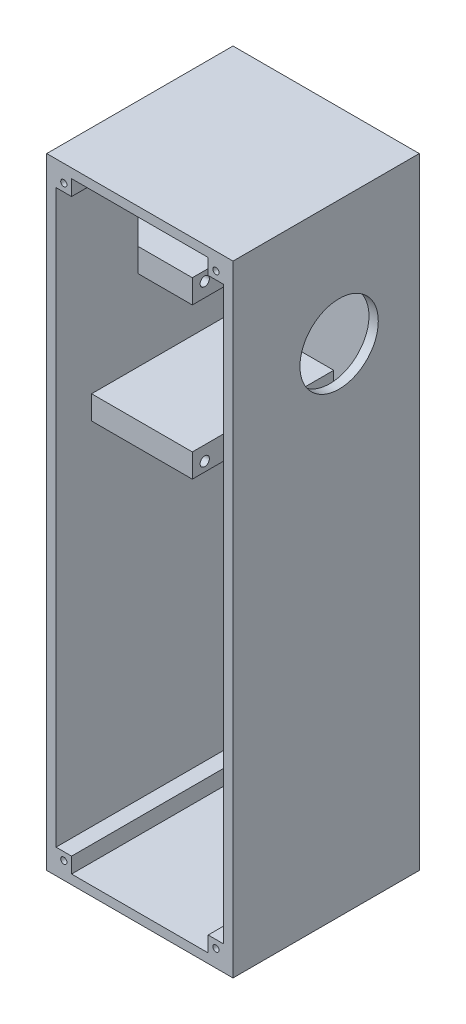
from build123d import *

# Parameters (mm, degrees)
SZKIC1_W                    = 60
SZKIC1_H                    = 60
DODANIE_WYCI_GNI_CIE1_DEPTH = 200
SKORUPA1_T                  = -3
SZKIC2_W                    = 5
SZKIC2_H                    = 5
SZKIC2_R                    = 1
DODANIE_WYCI_GNI_CIE2_DEPTH = 57
SZKIC4_W                    = 5
SZKIC4_H                    = 5
SZKIC4_R                    = 1
DODANIE_WYCI_GNI_CIE3_DEPTH = 57
SZKIC5_W                    = 5
SZKIC5_H                    = 5
SZKIC5_R                    = 1
DODANIE_WYCI_GNI_CIE4_DEPTH = 57
SZKIC6_W                    = 5
SZKIC6_H                    = 5
SZKIC6_R                    = 1
DODANIE_WYCI_GNI_CIE6_DEPTH = 57
SZKIC9_R                    = 12.625
WYTNIJ_WYCI_GNI_CIE1_DEPTH  = 3
SZKIC10_W                   = 45.55
SZKIC10_H                   = 7.6
DODANIE_WYCI_GNI_CIE7_DEPTH = 32.45
SZKIC13_R                   = 1.5
WYTNIJ_WYCI_GNI_CIE4_DEPTH  = 5
SZKIC14_R                   = 1.5
WYTNIJ_WYCI_GNI_CIE5_DEPTH  = 5
WYTNIJ_WYCI_GNI_CIE7_DEPTH  = 10


with BuildPart() as part:
    # Szkic1 → Dodanie-wyciągnięcie1 (new body)
    with BuildSketch(Plane(origin=(0, 0, 0), x_dir=(1, 0, 0), z_dir=(0, 1, 0))):
        with Locations((30, 30)):
            Rectangle(SZKIC1_W, SZKIC1_H)
    extrude(amount=DODANIE_WYCI_GNI_CIE1_DEPTH)

    # Skorupa1
    skorupa1_openings = [part.faces().sort_by_distance(p)[0] for p in [
        (30, 100, 0),
    ]]
    offset(amount=SKORUPA1_T, openings=skorupa1_openings, kind=Kind.INTERSECTION)

    # Szkic2 → Dodanie-wyciągnięcie2 (add)
    with BuildSketch(Plane.XY.offset(-57)):
        with Locations((5.5, 194.5)):
            Rectangle(SZKIC2_W, SZKIC2_H)
        with Locations(Location((5.5, 194.5, 0), (0, 0, 180))):
            Circle(SZKIC2_R, mode=Mode.SUBTRACT)
    extrude(amount=DODANIE_WYCI_GNI_CIE2_DEPTH)

    # Szkic4 → Dodanie-wyciągnięcie3 (add)
    with BuildSketch(Plane.XY):
        with Locations((54.5, 194.5)):
            Rectangle(SZKIC4_W, SZKIC4_H)
        with Locations((54.5, 194.5)):
            Circle(SZKIC4_R, mode=Mode.SUBTRACT)
    extrude(amount=-DODANIE_WYCI_GNI_CIE3_DEPTH)

    # Szkic5 → Dodanie-wyciągnięcie4 (add)
    with BuildSketch(Plane.XY.offset(-57)):
        with Locations((5.5, 5.5)):
            Rectangle(SZKIC5_W, SZKIC5_H)
        with Locations(Location((5.5, 5.5, 0), (0, 0, 180))):
            Circle(SZKIC5_R, mode=Mode.SUBTRACT)
    extrude(amount=DODANIE_WYCI_GNI_CIE4_DEPTH)

    # Szkic6 → Dodanie-wyciągnięcie6 (add)
    with BuildSketch(Plane.XY.offset(-57)):
        with Locations((54.5, 5.5)):
            Rectangle(SZKIC6_W, SZKIC6_H)
        with Locations(Location((54.5, 5.5, 0), (0, 0, 180))):
            Circle(SZKIC6_R, mode=Mode.SUBTRACT)
    extrude(amount=DODANIE_WYCI_GNI_CIE6_DEPTH)

    # Szkic9 → Wytnij-wyciągnięcie1 (cut)
    with BuildSketch(Plane(origin=(60, 0, 0), x_dir=(0, 0, -1), z_dir=(1, 0, 0))):
        with Locations((34.18, 159.82)):
            Circle(SZKIC9_R)
    extrude(amount=-WYTNIJ_WYCI_GNI_CIE1_DEPTH, mode=Mode.SUBTRACT)

    # Szkic10 → Dodanie-wyciągnięcie7 (add)
    with BuildSketch(Plane(origin=(3, 0, 0), x_dir=(0, 0, -1), z_dir=(1, 0, 0))):
        with Locations((34.225, 173.56)):
            Rectangle(SZKIC10_W, SZKIC10_H)
        with Locations((34.225, 124.96)):
            Rectangle(SZKIC10_W, SZKIC10_H)
    extrude(amount=DODANIE_WYCI_GNI_CIE7_DEPTH)

    # Szkic13 → Wytnij-wyciągnięcie4 (cut)
    with BuildSketch(Plane(origin=(35.45, 0, 0), x_dir=(0, 0, -1), z_dir=(1, 0, 0))):
        with Locations((25.1, 174.36)):
            Circle(SZKIC13_R)
        with Locations((15.45, 174.36)):
            Circle(SZKIC13_R)
    extrude(amount=-WYTNIJ_WYCI_GNI_CIE4_DEPTH, mode=Mode.SUBTRACT)

    # Szkic14 → Wytnij-wyciągnięcie5 (cut)
    with BuildSketch(Plane(origin=(35.45, 0, 0), x_dir=(0, 0, -1), z_dir=(1, 0, 0))):
        with Locations((25.6, 124.16)):
            Circle(SZKIC14_R)
        with Locations((15.45, 124.16)):
            Circle(SZKIC14_R)
    extrude(amount=-WYTNIJ_WYCI_GNI_CIE5_DEPTH, mode=Mode.SUBTRACT)

    # Szkic15 → Wytnij-wyciągnięcie7 (cut)
    with BuildSketch(Plane(origin=(0, 177.36, 0), x_dir=(1, 0, 0), z_dir=(0, 1, 0))):
        Polygon((17.95, 11.45), (3, 11.45), (3, 26.45), align=None)
    extrude(amount=-WYTNIJ_WYCI_GNI_CIE7_DEPTH, mode=Mode.SUBTRACT)


solid = part.part
